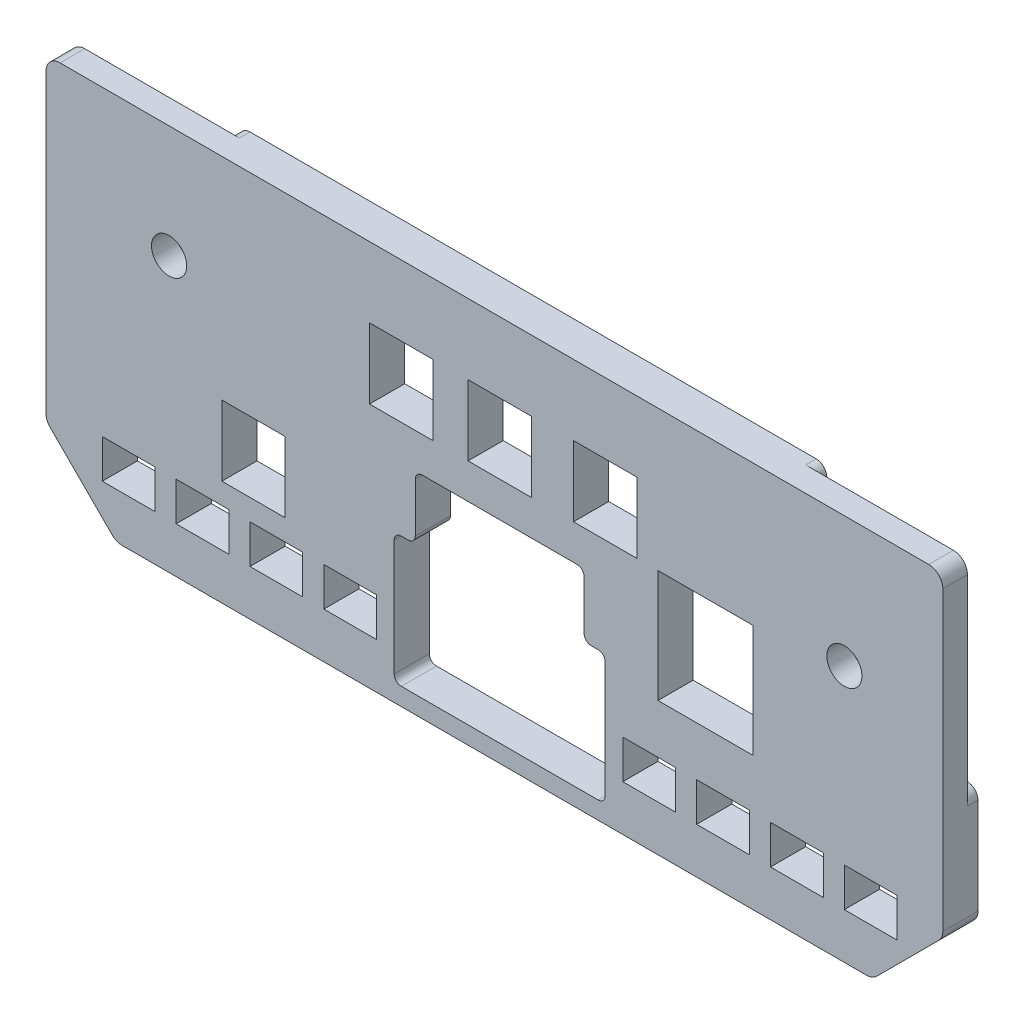
from build123d import *

# Parameters (mm, degrees)
SKETCH1_W           = 18
SKETCH1_H           = 20
SKETCH1_W_2         = 27
SKETCH1_H_2         = 32
BOSS_EXTRUDE1_DEPTH = 10
SKETCH2_W           = 15
SKETCH2_H           = 11
CUT_EXTRUDE1_DEPTH  = 10
CUT_EXTRUDE2_DEPTH  = 3
FILLET1_R           = 3
FILLET2_R           = 3
FILLET3_R           = 3
FILLET4_R           = 3
FILLET5_R           = 3
CUT_EXTRUDE3_DEPTH  = 10
SKETCH5_R           = 5
CUT_EXTRUDE4_DEPTH  = 7


with BuildPart() as part:
    # Sketch1 → Boss-Extrude1 (new body)
    with BuildSketch(Plane.XY):
        with BuildLine():
            Line((-168.654215956, -33.412313616), (-150.997361707, -51.069167865))
            ThreePointArc((-150.997361707, -51.069167865), (-149.699668311, -51.936258871), (-148.168934582, -52.240740741))
            Line((-148.168934582, -52.240740741), (63.517356919, -52.240740741))
            ThreePointArc((63.517356919, -52.240740741), (65.048090649, -51.936258871), (66.345784044, -51.069167865))
            Line((66.345784044, -51.069167865), (84.002638293, -33.412313616))
            ThreePointArc((84.002638293, -33.412313616), (84.869729299, -32.114620221), (85.174211169, -30.583886491))
            Line((85.174211169, -30.583886491), (85.174211169, 53.759259259))
            ThreePointArc((85.174211169, 53.759259259), (84.002638293, 56.587686384), (81.174211169, 57.759259259))
            Line((81.174211169, 57.759259259), (-165.825788831, 57.759259259))
            ThreePointArc((-165.825788831, 57.759259259), (-168.654215956, 56.587686384), (-169.825788831, 53.759259259))
            Line((-169.825788831, 53.759259259), (-169.825788831, -30.583886491))
            ThreePointArc((-169.825788831, -30.583886491), (-169.521306961, -32.114620221), (-168.654215956, -33.412313616))
        make_face()
        with Locations((-68.825788831, 27.759259259)):
            Rectangle(SKETCH1_W, SKETCH1_H, mode=Mode.SUBTRACT)
        with Locations((-40.825788831, 27.759259259)):
            Rectangle(SKETCH1_W, SKETCH1_H, mode=Mode.SUBTRACT)
        with Locations((-10.825788831, 27.759259259)):
            Rectangle(SKETCH1_W, SKETCH1_H, mode=Mode.SUBTRACT)
        with Locations((-110.825788831, -12.240740741)):
            Rectangle(SKETCH1_W, SKETCH1_H, mode=Mode.SUBTRACT)
        with Locations((17.674211169, 1.759259259)):
            Rectangle(SKETCH1_W_2, SKETCH1_H_2, mode=Mode.SUBTRACT)
    extrude(amount=BOSS_EXTRUDE1_DEPTH)

    # Sketch2 → Cut-Extrude1 (cut)
    with BuildSketch(Plane.XY.offset(10)):
        with Locations((-146.325788831, -33.740740741)):
            Rectangle(SKETCH2_W, SKETCH2_H)
        with Locations((-125.325788831, -33.740740741)):
            Rectangle(SKETCH2_W, SKETCH2_H)
        with Locations((-104.325788831, -33.740740741)):
            Rectangle(SKETCH2_W, SKETCH2_H)
        with Locations((-83.325788831, -33.740740741)):
            Rectangle(SKETCH2_W, SKETCH2_H)
        with Locations((1.674211169, -33.740740741)):
            Rectangle(SKETCH2_W, SKETCH2_H)
        with Locations((22.674211169, -33.740740741)):
            Rectangle(SKETCH2_W, SKETCH2_H)
        with Locations((43.674211169, -33.740740741)):
            Rectangle(SKETCH2_W, SKETCH2_H)
        with Locations((64.674211169, -33.740740741)):
            Rectangle(SKETCH2_W, SKETCH2_H)
    extrude(amount=-CUT_EXTRUDE1_DEPTH, mode=Mode.SUBTRACT)

    # Sketch3 → Cut-Extrude2 (cut)
    with BuildSketch(Plane(origin=(0, 0, 0), x_dir=(-1, 0, 0), z_dir=(0, 0, -1))):
        with BuildLine():
            Line((-42.174211169, 57.759259259), (-85.174211169, 57.759259259))
            Line((-85.174211169, 57.759259259), (-85.174211169, -0.240740741))
            Line((-85.174211169, -0.240740741), (-50.174211169, -0.240740741))
            ThreePointArc((-50.174211169, -0.240740741), (-44.517356919, 2.10240501), (-42.174211169, 7.759259259))
            Line((-42.174211169, 7.759259259), (-42.174211169, 57.759259259))
        make_face()
        with BuildLine():
            Line((124.825788831, 57.759259259), (169.825788831, 57.759259259))
            Line((169.825788831, 57.759259259), (169.825788831, -2.240740741))
            Line((169.825788831, -2.240740741), (148.825788831, -2.240740741))
            Line((148.825788831, -2.240740741), (148.825788831, -6.240740741))
            ThreePointArc((148.825788831, -6.240740741), (147.947109175, -8.362061084), (145.825788831, -9.240740741))
            Line((145.825788831, -9.240740741), (127.825788831, -9.240740741))
            ThreePointArc((127.825788831, -9.240740741), (125.704468488, -8.362061084), (124.825788831, -6.240740741))
            Line((124.825788831, -6.240740741), (124.825788831, -1.240740741))
            Line((124.825788831, -1.240740741), (124.825788831, 57.759259259))
        make_face()
    extrude(amount=-CUT_EXTRUDE2_DEPTH, mode=Mode.SUBTRACT)

    # Fillet1
    fillet1_edges = [part.edges().sort_by_distance(p)[0] for p in [
        (-148.825788831, -2.240740741, 1.5),
    ]]
    fillet(fillet1_edges, radius=FILLET1_R)

    # Fillet2
    fillet2_edges = [part.edges().sort_by_distance(p)[0] for p in [
        (-169.825788831, -2.240740741, 1.5),
    ]]
    fillet(fillet2_edges, radius=FILLET2_R)

    # Fillet3
    fillet3_edges = [part.edges().sort_by_distance(p)[0] for p in [
        (-124.825788831, 57.759259259, 1.5),
    ]]
    fillet(fillet3_edges, radius=FILLET3_R)

    # Fillet4
    fillet4_edges = [part.edges().sort_by_distance(p)[0] for p in [
        (42.174211169, 57.759259259, 1.5),
    ]]
    fillet(fillet4_edges, radius=FILLET4_R)

    # Fillet5
    fillet5_edges = [part.edges().sort_by_distance(p)[0] for p in [
        (85.174211169, -0.240740741, 1.5),
    ]]
    fillet(fillet5_edges, radius=FILLET5_R)

    # Sketch4 → Cut-Extrude3 (cut)
    with BuildSketch(Plane(origin=(0, 0, 0), x_dir=(-1, 0, 0), z_dir=(0, 0, -1))):
        with BuildLine():
            Line((68.825788831, -47.240740741), (12.825788831, -47.240740741))
            ThreePointArc((12.825788831, -47.240740741), (11.411575269, -46.654954303), (10.825788831, -45.240740741))
            Line((10.825788831, -45.240740741), (10.825788831, -12.240740741))
            ThreePointArc((10.825788831, -12.240740741), (11.411575269, -10.826527178), (12.825788831, -10.240740741))
            Line((12.825788831, -10.240740741), (14.825788831, -10.240740741))
            ThreePointArc((14.825788831, -10.240740741), (16.240002394, -9.654954303), (16.825788831, -8.240740741))
            Line((16.825788831, -8.240740741), (16.825788831, 5.759259259))
            ThreePointArc((16.825788831, 5.759259259), (17.411575269, 7.173472822), (18.825788831, 7.759259259))
            Line((18.825788831, 7.759259259), (62.825788831, 7.759259259))
            ThreePointArc((62.825788831, 7.759259259), (64.240002394, 7.173472822), (64.825788831, 5.759259259))
            Line((64.825788831, 5.759259259), (64.825788831, -8.240740741))
            ThreePointArc((64.825788831, -8.240740741), (65.411575269, -9.654954303), (66.825788831, -10.240740741))
            Line((66.825788831, -10.240740741), (68.825788831, -10.240740741))
            ThreePointArc((68.825788831, -10.240740741), (70.240002394, -10.826527178), (70.825788831, -12.240740741))
            Line((70.825788831, -12.240740741), (70.825788831, -45.240740741))
            ThreePointArc((70.825788831, -45.240740741), (70.240002394, -46.654954303), (68.825788831, -47.240740741))
        make_face()
    extrude(amount=-CUT_EXTRUDE3_DEPTH, mode=Mode.SUBTRACT)

    # Sketch5 → Cut-Extrude4 (cut)
    with BuildSketch(Plane(origin=(0, 0, 3), x_dir=(-1, 0, 0), z_dir=(0, 0, -1))):
        with Locations((-57.174211169, 20.759259259)):
            Circle(SKETCH5_R)
        with Locations((134.825788831, 25.759259259)):
            Circle(SKETCH5_R)
    extrude(amount=-CUT_EXTRUDE4_DEPTH, mode=Mode.SUBTRACT)


solid = part.part
